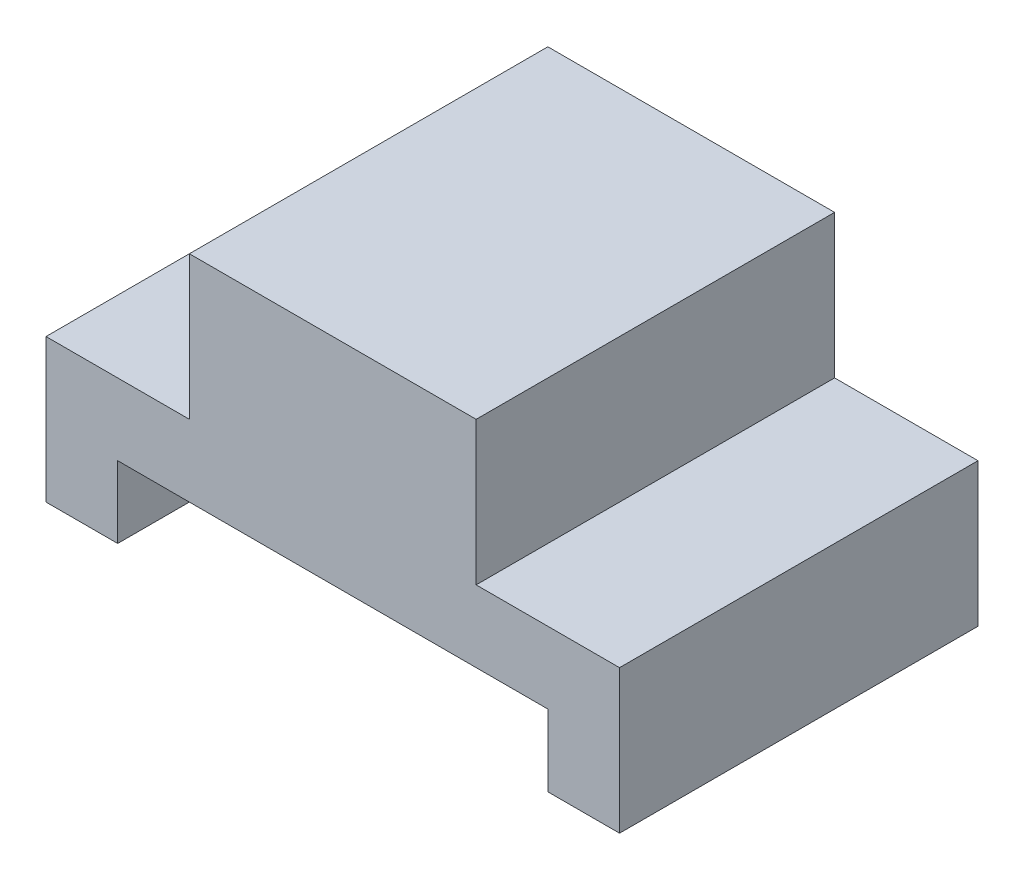
from build123d import *

# Parameters (mm, degrees)
CROQUIS2_W              = 8000
CROQUIS2_H              = 5000
SALIENTE_EXTRUIR1_DEPTH = 1000
CROQUIS3_W              = 4000
CROQUIS3_H              = 5000
SALIENTE_EXTRUIR2_DEPTH = 2000
CROQUIS4_2_W            = 1000
CROQUIS4_2_H            = 5000
SALIENTE_EXTRUIR4_DEPTH = 1000


with BuildPart() as part:
    # Croquis2 → Saliente-Extruir1 (new body)
    with BuildSketch(Plane(origin=(0, 0, 0), x_dir=(1, 0, 0), z_dir=(0, 1, 0))):
        with Locations((-3950, -2300.531749032)):
            Rectangle(CROQUIS2_W, CROQUIS2_H)
    extrude(amount=SALIENTE_EXTRUIR1_DEPTH)

    # Croquis3 → Saliente-Extruir2 (add)
    with BuildSketch(Plane(origin=(0, 1000, 0), x_dir=(1, 0, 0), z_dir=(0, 1, 0))):
        with Locations((-3950, -2300.531749032)):
            Rectangle(CROQUIS3_W, CROQUIS3_H)
    extrude(amount=SALIENTE_EXTRUIR2_DEPTH)

    # Croquis4<2> → Saliente-Extruir4 (add)
    with BuildSketch(Plane.XZ):
        with Locations((-7450, 2300.531749032)):
            Rectangle(CROQUIS4_2_W, CROQUIS4_2_H)
        with Locations((-450, 2300.531749032)):
            Rectangle(CROQUIS4_2_W, CROQUIS4_2_H)
    extrude(amount=SALIENTE_EXTRUIR4_DEPTH)


solid = part.part
